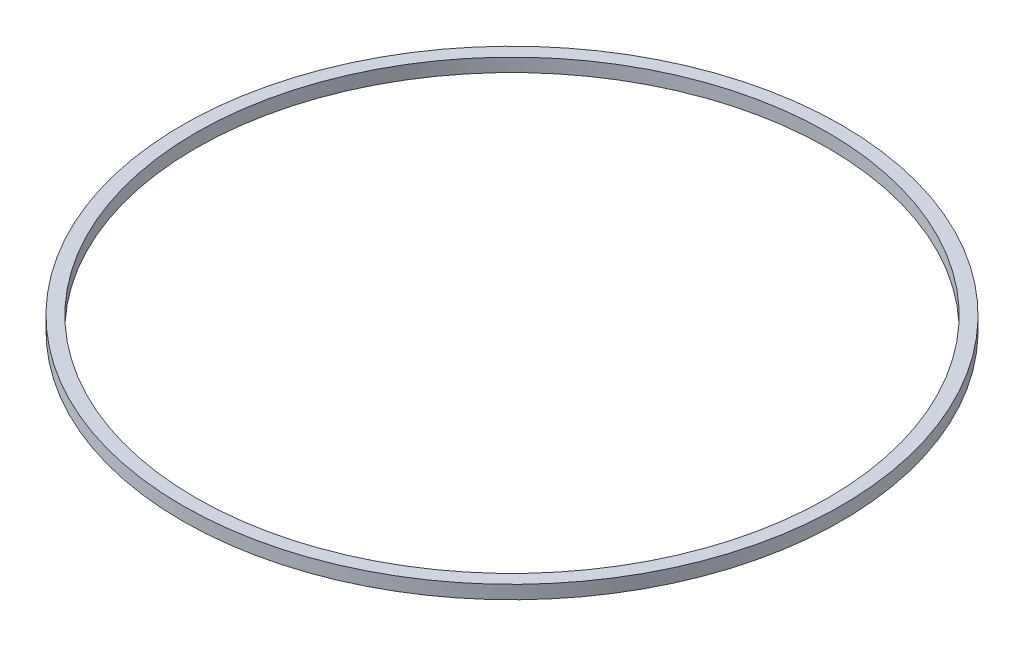
from build123d import *

# Parameters (mm, degrees)
SKETCH1_W = 2.121320344
SKETCH1_H = 2.121320344


with BuildPart() as part:
    # Sketch1 → Revolve1 (revolve)
    with BuildSketch(Plane.XY, mode=Mode.PRIVATE) as revolve1_sk:
        with Locations((-51.194460172, 1.060660172)):
            Rectangle(SKETCH1_W, SKETCH1_H)
    revolve(revolve1_sk.sketch.rotate(Axis((0, 0, 0), (0, 1, 0)), 270), axis=Axis((0, 0, 0), (0, 1, 0)))


solid = part.part
